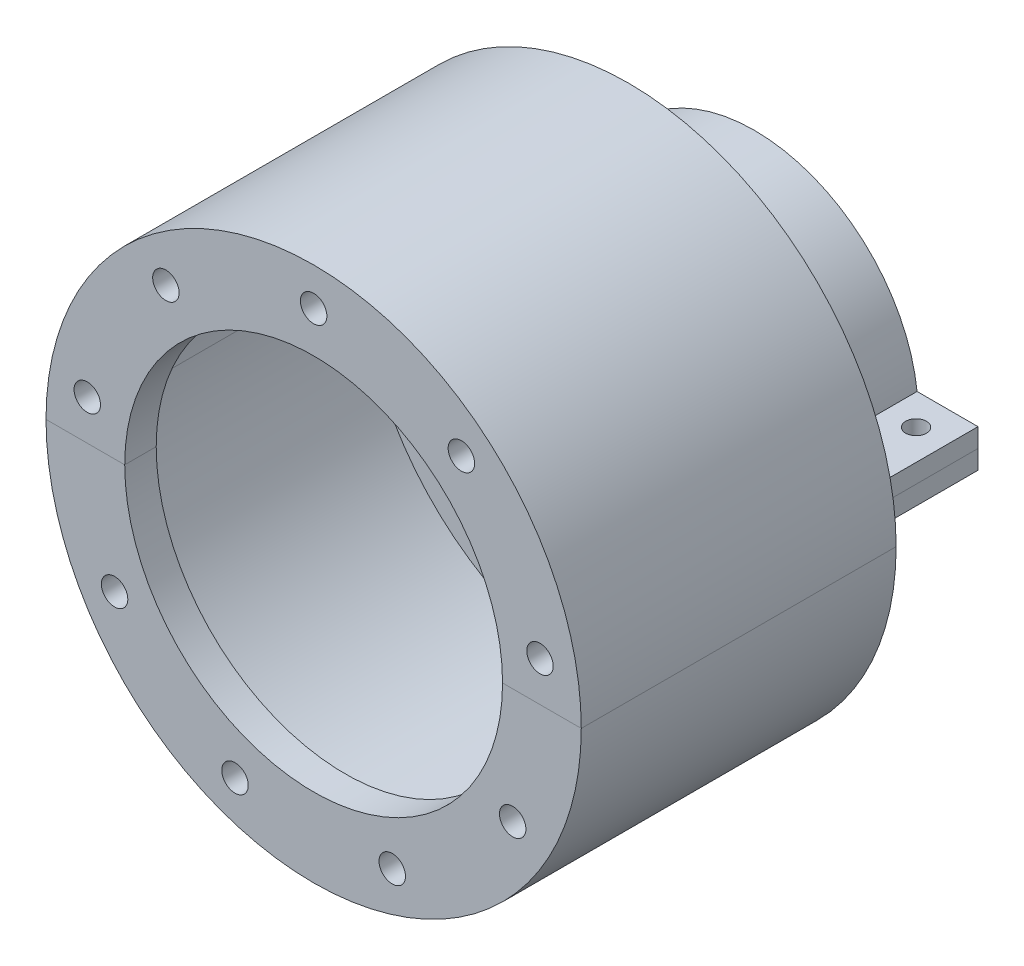
from build123d import *

# Parameters (mm, degrees)
SKETCH_1_R           = 42.5
EXTRUDE_1_DEPTH      = 3
SKETCH_2_R           = 42.5
SKETCH_2_R_2         = 39.5
EXTRUDE_2_DEPTH      = 42
SKETCH_3_R           = 42.5
SKETCH_3_R_2         = 30
EXTRUDE_3_DEPTH      = 5
CUT_EXTRUDE_1_REACH  = 80.182
SKETCH_4_R           = 2.1
SKETCH_5_R           = 26
SKETCH_5_R_2         = 23.1
EXTRUDE_4_DEPTH      = 20
EXTRUDE_5_DEPTH      = 3
EXTRUDE_5_DEPTH_BACK = 3
SKETCH_6_W           = 11
SKETCH_6_H           = 20
CUT_EXTRUDE_2_REACH  = 81.853
SKETCH_7_R           = 1.65


with BuildPart() as part:
    # ｽｹｯﾁ1 → ﾎﾞｽ - 押し出し1 (new body)
    with BuildSketch(Plane.XY):
        Circle(SKETCH_1_R)
    extrude(amount=EXTRUDE_1_DEPTH)

    # ｽｹｯﾁ2 → ﾎﾞｽ - 押し出し2 (add)
    with BuildSketch(Plane.XY.offset(3)):
        Circle(SKETCH_2_R)
        Circle(SKETCH_2_R_2, mode=Mode.SUBTRACT)
    extrude(amount=EXTRUDE_2_DEPTH)

    # ｽｹｯﾁ3 → ﾎﾞｽ - 押し出し3 (add)
    with BuildSketch(Plane.XY.offset(45)):
        Circle(SKETCH_3_R)
        Circle(SKETCH_3_R_2, mode=Mode.SUBTRACT)
    extrude(amount=EXTRUDE_3_DEPTH)

    # ｽｹｯﾁ4 → ｶｯﾄ - 押し出し1 (cut, up to next)
    with BuildSketch(Plane.XY.offset(50), mode=Mode.PRIVATE) as cut_extrude_1_sk1:
        with Locations((0, 36.5)):
            Circle(SKETCH_4_R)
    cut_extrude_1_tool1 = extrude(cut_extrude_1_sk1.sketch, amount=-CUT_EXTRUDE_1_REACH, mode=Mode.PRIVATE) & part.part
    # ｽｹｯﾁ4 → ｶｯﾄ - 押し出し1 (cut, up to next)
    with BuildSketch(Plane.XY.offset(50), mode=Mode.PRIVATE) as cut_extrude_1_sk2:
        with Locations((23.461747754, 27.960622174)):
            Circle(SKETCH_4_R)
    cut_extrude_1_tool2 = extrude(cut_extrude_1_sk2.sketch, amount=-CUT_EXTRUDE_1_REACH, mode=Mode.PRIVATE) & part.part
    # ｽｹｯﾁ4 → ｶｯﾄ - 押し出し1 (cut, up to next)
    with BuildSketch(Plane.XY.offset(50), mode=Mode.PRIVATE) as cut_extrude_1_sk3:
        with Locations((35.945482985, 6.338158485)):
            Circle(SKETCH_4_R)
    cut_extrude_1_tool3 = extrude(cut_extrude_1_sk3.sketch, amount=-CUT_EXTRUDE_1_REACH, mode=Mode.PRIVATE) & part.part
    # ｽｹｯﾁ4 → ｶｯﾄ - 押し出し1 (cut, up to next)
    with BuildSketch(Plane.XY.offset(50), mode=Mode.PRIVATE) as cut_extrude_1_sk4:
        with Locations((31.609927238, -18.25)):
            Circle(SKETCH_4_R)
    cut_extrude_1_tool4 = extrude(cut_extrude_1_sk4.sketch, amount=-CUT_EXTRUDE_1_REACH, mode=Mode.PRIVATE) & part.part
    # ｽｹｯﾁ4 → ｶｯﾄ - 押し出し1 (cut, up to next)
    with BuildSketch(Plane.XY.offset(50), mode=Mode.PRIVATE) as cut_extrude_1_sk5:
        with Locations((12.483735231, -34.298780659)):
            Circle(SKETCH_4_R)
    cut_extrude_1_tool5 = extrude(cut_extrude_1_sk5.sketch, amount=-CUT_EXTRUDE_1_REACH, mode=Mode.PRIVATE) & part.part
    # ｽｹｯﾁ4 → ｶｯﾄ - 押し出し1 (cut, up to next)
    with BuildSketch(Plane.XY.offset(50), mode=Mode.PRIVATE) as cut_extrude_1_sk6:
        with Locations((-12.483735231, -34.298780659)):
            Circle(SKETCH_4_R)
    cut_extrude_1_tool6 = extrude(cut_extrude_1_sk6.sketch, amount=-CUT_EXTRUDE_1_REACH, mode=Mode.PRIVATE) & part.part
    # ｽｹｯﾁ4 → ｶｯﾄ - 押し出し1 (cut, up to next)
    with BuildSketch(Plane.XY.offset(50), mode=Mode.PRIVATE) as cut_extrude_1_sk7:
        with Locations((-31.609927238, -18.25)):
            Circle(SKETCH_4_R)
    cut_extrude_1_tool7 = extrude(cut_extrude_1_sk7.sketch, amount=-CUT_EXTRUDE_1_REACH, mode=Mode.PRIVATE) & part.part
    # ｽｹｯﾁ4 → ｶｯﾄ - 押し出し1 (cut, up to next)
    with BuildSketch(Plane.XY.offset(50), mode=Mode.PRIVATE) as cut_extrude_1_sk8:
        with Locations((-35.945482985, 6.338158485)):
            Circle(SKETCH_4_R)
    cut_extrude_1_tool8 = extrude(cut_extrude_1_sk8.sketch, amount=-CUT_EXTRUDE_1_REACH, mode=Mode.PRIVATE) & part.part
    # ｽｹｯﾁ4 → ｶｯﾄ - 押し出し1 (cut, up to next)
    with BuildSketch(Plane.XY.offset(50), mode=Mode.PRIVATE) as cut_extrude_1_sk9:
        with Locations((-23.461747754, 27.960622174)):
            Circle(SKETCH_4_R)
    cut_extrude_1_tool9 = extrude(cut_extrude_1_sk9.sketch, amount=-CUT_EXTRUDE_1_REACH, mode=Mode.PRIVATE) & part.part
    add(cut_extrude_1_tool1.solids().sort_by_distance((0, 36.5, 50))[0], mode=Mode.SUBTRACT)
    add(cut_extrude_1_tool2.solids().sort_by_distance((23.461748, 27.960622, 50))[0], mode=Mode.SUBTRACT)
    add(cut_extrude_1_tool3.solids().sort_by_distance((35.945483, 6.338158, 50))[0], mode=Mode.SUBTRACT)
    add(cut_extrude_1_tool4.solids().sort_by_distance((31.609927, -18.25, 50))[0], mode=Mode.SUBTRACT)
    add(cut_extrude_1_tool5.solids().sort_by_distance((12.483735, -34.298781, 50))[0], mode=Mode.SUBTRACT)
    add(cut_extrude_1_tool6.solids().sort_by_distance((-12.483735, -34.298781, 50))[0], mode=Mode.SUBTRACT)
    add(cut_extrude_1_tool7.solids().sort_by_distance((-31.609927, -18.25, 50))[0], mode=Mode.SUBTRACT)
    add(cut_extrude_1_tool8.solids().sort_by_distance((-35.945483, 6.338158, 50))[0], mode=Mode.SUBTRACT)
    add(cut_extrude_1_tool9.solids().sort_by_distance((-23.461748, 27.960622, 50))[0], mode=Mode.SUBTRACT)

    # ｽｹｯﾁ5 → ﾎﾞｽ - 押し出し4 (add)
    with BuildSketch(Plane(origin=(0, 0, 0), x_dir=(-1, 0, 0), z_dir=(0, 0, -1))):
        Circle(SKETCH_5_R)
        Circle(SKETCH_5_R_2, mode=Mode.SUBTRACT)
    extrude(amount=EXTRUDE_4_DEPTH)

    # ｽｹｯﾁ6 → ﾎﾞｽ - 押し出し5 (add, two sides: drawn at the far end of the back side and taken through both)
    with BuildSketch(Plane(origin=(0, 0, 0), x_dir=(1, 0, 0), z_dir=(0, 1, 0)).offset(-EXTRUDE_5_DEPTH_BACK)):
        with Locations((-30, 10)):
            Rectangle(SKETCH_6_W, SKETCH_6_H)
        with Locations((30, 10)):
            Rectangle(SKETCH_6_W, SKETCH_6_H)
    extrude(amount=EXTRUDE_5_DEPTH + EXTRUDE_5_DEPTH_BACK)

    # ｽｹｯﾁ7 → ｶｯﾄ - 押し出し2 (cut, up to next)
    with BuildSketch(Plane(origin=(0, 3, 0), x_dir=(1, 0, 0), z_dir=(0, 1, 0)), mode=Mode.PRIVATE) as cut_extrude_2_sk1:
        with Locations((-30.66317157, 15)):
            Circle(SKETCH_7_R)
    cut_extrude_2_tool1 = extrude(cut_extrude_2_sk1.sketch, amount=-CUT_EXTRUDE_2_REACH, mode=Mode.PRIVATE) & part.part
    # ｽｹｯﾁ7 → ｶｯﾄ - 押し出し2 (cut, up to next)
    with BuildSketch(Plane(origin=(0, 3, 0), x_dir=(1, 0, 0), z_dir=(0, 1, 0)), mode=Mode.PRIVATE) as cut_extrude_2_sk2:
        with Locations((-30.66317157, 5)):
            Circle(SKETCH_7_R)
    cut_extrude_2_tool2 = extrude(cut_extrude_2_sk2.sketch, amount=-CUT_EXTRUDE_2_REACH, mode=Mode.PRIVATE) & part.part
    # ｽｹｯﾁ7 → ｶｯﾄ - 押し出し2 (cut, up to next)
    with BuildSketch(Plane(origin=(0, 3, 0), x_dir=(1, 0, 0), z_dir=(0, 1, 0)), mode=Mode.PRIVATE) as cut_extrude_2_sk3:
        with Locations((30.66317157, 5)):
            Circle(SKETCH_7_R)
    cut_extrude_2_tool3 = extrude(cut_extrude_2_sk3.sketch, amount=-CUT_EXTRUDE_2_REACH, mode=Mode.PRIVATE) & part.part
    # ｽｹｯﾁ7 → ｶｯﾄ - 押し出し2 (cut, up to next)
    with BuildSketch(Plane(origin=(0, 3, 0), x_dir=(1, 0, 0), z_dir=(0, 1, 0)), mode=Mode.PRIVATE) as cut_extrude_2_sk4:
        with Locations((30.66317157, 15)):
            Circle(SKETCH_7_R)
    cut_extrude_2_tool4 = extrude(cut_extrude_2_sk4.sketch, amount=-CUT_EXTRUDE_2_REACH, mode=Mode.PRIVATE) & part.part
    add(cut_extrude_2_tool1.solids().sort_by_distance((-30.663172, 3, -15))[0], mode=Mode.SUBTRACT)
    add(cut_extrude_2_tool2.solids().sort_by_distance((-30.663172, 3, -5))[0], mode=Mode.SUBTRACT)
    add(cut_extrude_2_tool3.solids().sort_by_distance((30.663172, 3, -5))[0], mode=Mode.SUBTRACT)
    add(cut_extrude_2_tool4.solids().sort_by_distance((30.663172, 3, -15))[0], mode=Mode.SUBTRACT)


with BuildPart() as body_2:
    # Split Bodies 1: the piece on the far side of the plane
    add(part.part)
    split(bisect_by=Plane.ZX, keep=Keep.BOTTOM)


with BuildPart() as part_1:
    add(part.part)

    # Split Bodies 1
    split(bisect_by=Plane.ZX, keep=Keep.TOP)


solid = Compound([body_2.part, part_1.part])
